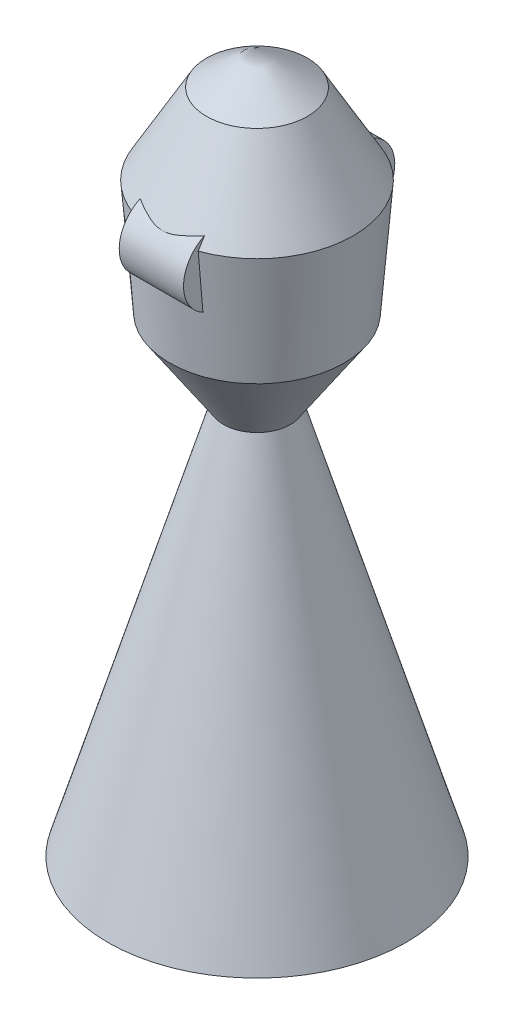
from build123d import *

# Parameters (mm, degrees)
SKETCH2_R           = 160
BOSS_EXTRUDE1_DEPTH = 140


with BuildPart() as part:
    # Sketch1 → Revolve1 (revolve)
    with BuildSketch(Plane.XY, mode=Mode.PRIVATE) as revolve1_sk:
        Polygon((0, 3100), (220, 2950), (420, 2600), (380, 2100), (145, 1750), (650, 50), (620, 50), (125, 1750), (340, 2100), (340, 2600), (0, 2600), align=None)
    revolve(revolve1_sk.sketch.rotate(Axis((0, 0, 0), (0, 1, 0)), 90), axis=Axis((0, 0, 0), (0, 1, 0)))

    # Sketch2 → Boss-Extrude1 (add, symmetric)
    with BuildSketch(Plane(origin=(0, 0, 0), x_dir=(0, 0, -1), z_dir=(1, 0, 0))):
        with Locations((300, 2500)):
            Circle(SKETCH2_R)
        with Locations((-300, 2500)):
            Circle(SKETCH2_R)
    extrude(amount=BOSS_EXTRUDE1_DEPTH, both=True)


solid = part.part
